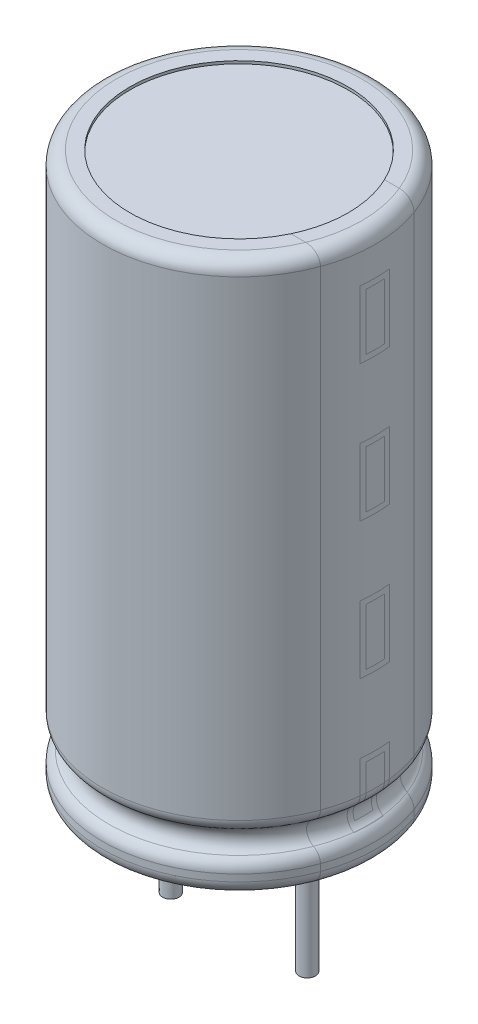
from build123d import *

# Parameters (mm, degrees)
SKETCH1_R             = 0.3
BOSS_EXTRUDE1_DEPTH   = 4.72
BOSS_EXTRUDE1_2_DEPTH = 4.72


with BuildPart() as part:
    # Sketch1 → Boss-Extrude1 (new body)
    with BuildSketch(Plane(origin=(0, 0, 0), x_dir=(1, 0, 0), z_dir=(0, 1, 0))):
        with Locations(Location((-2.5, 0, 0), (0, 0, 270))):
            Circle(SKETCH1_R)
    extrude(amount=-BOSS_EXTRUDE1_DEPTH)



with BuildPart() as body_2:
    # Sketch1 → Boss-Extrude1 2 (new body)
    with BuildSketch(Plane(origin=(0, 0, 0), x_dir=(1, 0, 0), z_dir=(0, 1, 0))):
        with Locations(Location((2.5, 0, 0), (0, 0, 90))):
            Circle(SKETCH1_R)
    extrude(amount=-BOSS_EXTRUDE1_2_DEPTH)


with BuildPart() as part_1:
    add(part.part)

    add(body_2.part)  # Revolve1 merges body 2
    # Sketch3 → Revolve1 (revolve)
    with BuildSketch(Plane.XY):
        with BuildLine():
            Line((5, 0.4), (5, 0.650521697))
            ThreePointArc((5, 0.650521697), (4.937148311, 0.893217708), (4.764394584, 1.074898303))
            ThreePointArc((4.764394584, 1.074898303), (4.528386612, 1.5), (4.764394584, 1.925101697))
            ThreePointArc((4.764394584, 1.925101697), (4.937148311, 2.106782292), (5, 2.349478303))
            Line((5, 2.349478303), (5, 19.6))
            ThreePointArc((5, 19.6), (4.853553391, 19.953553391), (4.5, 20.1))
            Line((4.5, 20.1), (4, 20.1))
            Line((4, 20.1), (4, 20))
            Line((4, 20), (0, 20))
            Line((0, 20), (0, 0))
            Line((0, 0), (4, 0))
            Line((4, 0), (4, -0.1))
            Line((4, -0.1), (4.5, -0.1))
            ThreePointArc((4.5, -0.1), (4.853553391, 0.046446609), (5, 0.4))
        make_face()
    revolve(axis=Axis((0, 0, 0), (0, 1, 0)))


solid = part_1.part
